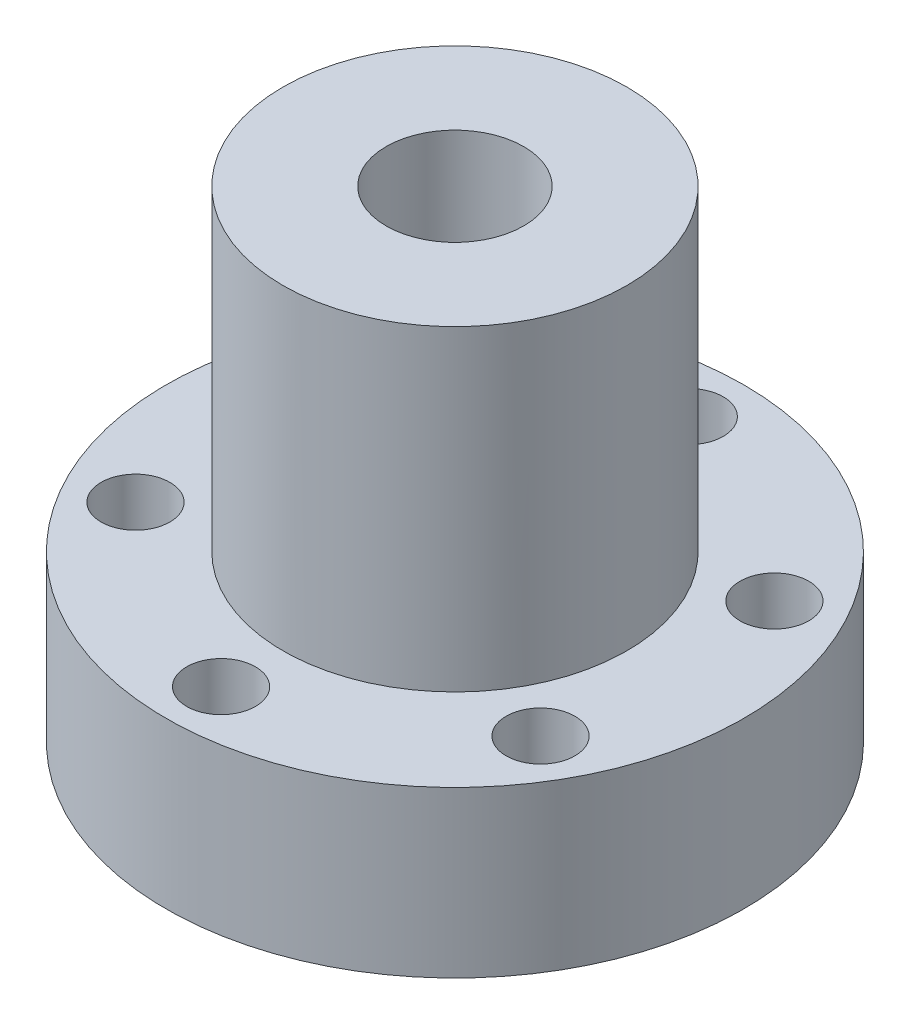
from build123d import *
from build123d.topology import SkipClean

# Parameters (mm, degrees)
SKETCH2_R           = 12.5
SKETCH2_R_2         = 5
BOSS_EXTRUDE1_DEPTH = 23
BOSS_EXTRUDE2_START = 12
SKETCH3_R           = 21
SKETCH3_R_2         = 5
BOSS_EXTRUDE2_DEPTH = 12
SKETCH4_R           = 2.5
CUT_EXTRUDE1_DEPTH  = 12


with BuildPart() as part:
    # Sketch2 → Boss-Extrude1 (new body)
    with BuildSketch(Plane(origin=(0, 0, 0), x_dir=(1, 0, 0), z_dir=(0, 1, 0))):
        with Locations(Location((0, 0, 0), (0, 0, 270))):
            Circle(SKETCH2_R)
        with Locations(Location((0, 0, 0), (0, 0, 270))):
            Circle(SKETCH2_R_2, mode=Mode.SUBTRACT)
    extrude(amount=BOSS_EXTRUDE1_DEPTH)

    # Sketch3 → Boss-Extrude2 (add)
    with SkipClean():  # the faces are left unmerged after this step: merging them gives an invalid solid
        with BuildSketch(Plane.XZ.offset(BOSS_EXTRUDE2_START)):
            with Locations(Location((0, 0, 0), (0, 0, 270))):
                Circle(SKETCH3_R)
            with Locations(Location((0, 0, 0), (0, 0, 270))):
                Circle(SKETCH3_R_2, mode=Mode.SUBTRACT)
        extrude(amount=-BOSS_EXTRUDE2_DEPTH)

    # Sketch4 → Cut-Extrude1 (cut)
    with SkipClean():  # the faces are left unmerged after this step: merging them gives an invalid solid
        with BuildSketch(Plane(origin=(0, 0, 0), x_dir=(1, 0, 0), z_dir=(0, 1, 0))):
            with Locations(Location((0, 17, 0), (0, 0, 270))):
                Circle(SKETCH4_R)
            with Locations(Location((14.722431864, 8.5, 0), (0, 0, 270))):
                Circle(SKETCH4_R)
            with Locations(Location((14.722431864, -8.5, 0), (0, 0, 270))):
                Circle(SKETCH4_R)
            with Locations(Location((0, -17, 0), (0, 0, 270))):
                Circle(SKETCH4_R)
            with Locations(Location((-14.722431864, -8.5, 0), (0, 0, 270))):
                Circle(SKETCH4_R)
            with Locations(Location((-14.722431864, 8.5, 0), (0, 0, 270))):
                Circle(SKETCH4_R)
        extrude(amount=-CUT_EXTRUDE1_DEPTH, mode=Mode.SUBTRACT)


solid = part.part
